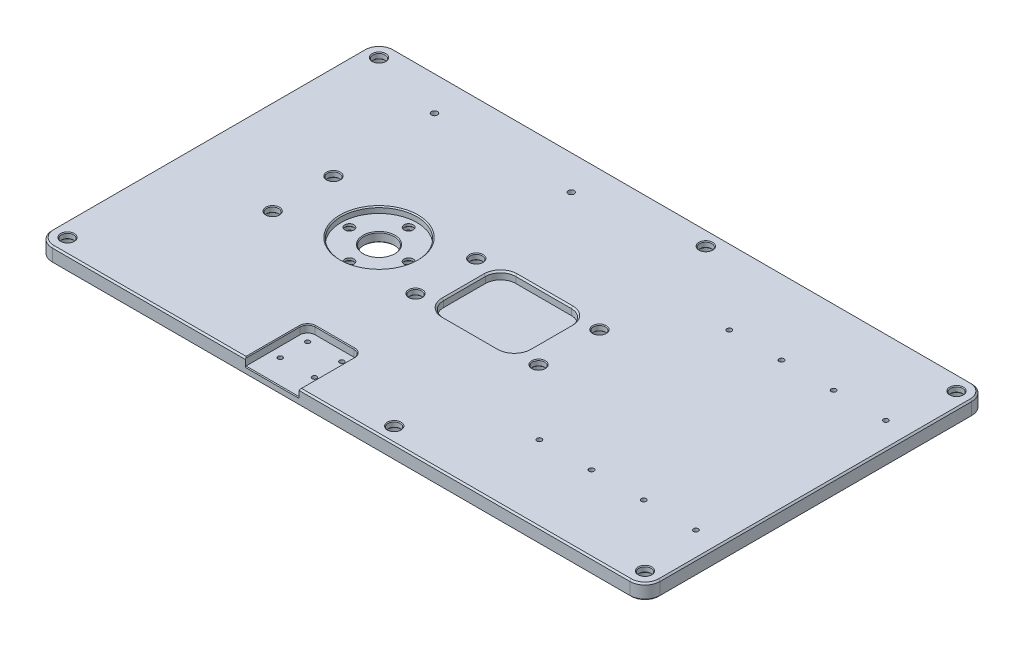
from build123d import *

# Parameters (mm, degrees)
SKICA2_W                  = 400
SKICA2_H                  = 225
P_IDAT_VYSUNUT_M1_DEPTH   = 10
SKICA3_R                  = 4
SKICA3_R_2                = 10
ODEBRAT_VYSUNUT_M1_DEPTH  = 10
SKICA4_R                  = 7.5
SKICA4_R_2                = 7
ODEBRAT_VYSUNUT_M2_DEPTH  = 6
ZAOBLIT1_R                = 10
SKICA6_R                  = 4
ODEBRAT_VYSUNUT_M4_DEPTH  = 10
SKICA7_R                  = 7.5
ODEBRAT_VYSUNUT_M5_DEPTH  = 6
ZKOSEN_1_SIZE             = 0.5
ZKOSEN_2_SIZE             = 0.5
ZKOSEN_3_SIZE             = 0.5
ZKOSEN_5_SIZE             = 1
SKICA8_R                  = 25
ODEBRAT_VYSUNUT_M6_DEPTH  = 4
SKICA10_R                 = 3
ODEBRAT_VYSUNUT_M7_DEPTH  = 6
SKICA11_R                 = 5.5
ODEBRAT_VYSUNUT_M8_DEPTH  = 4
ZKOSEN_7_SIZE             = 0.5
SKICA12_R                 = 1.6
ODEBRAT_VYSUNUT_M9_DEPTH  = 10
ODEBRAT_VYSUNUT_M10_DEPTH = 5
SKICA14_R                 = 1.5
ODEBRAT_VYSUNUT_M11_DEPTH = 5
SKICA15_W                 = 56.5
SKICA15_H                 = 47.5
ODEBRAT_VYSUNUT_M12_DEPTH = 5
ZAOBLIT2_R                = 10
SKICA16_R                 = 2
ODEBRAT_VYSUNUT_M13_DEPTH = 10
SKICA17_R                 = 4
ODEBRAT_VYSUNUT_M14_DEPTH = 4
ZKOSEN_8_SIZE             = 0.5
ZKOSEN_9_SIZE             = 0.5
ZKOSEN_10_SIZE            = 0.7
ZKOSEN_11_SIZE            = 1
ZKOSEN_12_SIZE            = 0.5
ZKOSEN_13_SIZE            = 0.5


with BuildPart() as part:
    # Skica2 → Přidat vysunutím1 (new body)
    with BuildSketch(Plane(origin=(0, 0, 0), x_dir=(1, 0, 0), z_dir=(0, 1, 0))):
        with Locations((200, 112.5)):
            Rectangle(SKICA2_W, SKICA2_H)
    extrude(amount=P_IDAT_VYSUNUT_M1_DEPTH)

    # Skica3 → Odebrat vysunutím1 (cut)
    with BuildSketch(Plane(origin=(0, 10, 0), x_dir=(1, 0, 0), z_dir=(0, 1, 0))):
        with Locations(Location((62.5, 92.5, 0), (0, 0, 270))):
            Circle(SKICA3_R)
        with Locations(Location((62.5, 132.5, 0), (0, 0, 270))):
            Circle(SKICA3_R)
        with Locations(Location((156.5, 92.5, 0), (0, 0, 270))):
            Circle(SKICA3_R)
        with Locations(Location((156.5, 132.5, 0), (0, 0, 270))):
            Circle(SKICA3_R)
        with Locations(Location((237.5, 92.5, 0), (0, 0, 270))):
            Circle(SKICA3_R)
        with Locations(Location((237.5, 132.5, 0), (0, 0, 270))):
            Circle(SKICA3_R)
        with Locations(Location((112.5, 112.5, 0), (0, 0, 270))):
            Circle(SKICA3_R_2)
    extrude(amount=-ODEBRAT_VYSUNUT_M1_DEPTH, mode=Mode.SUBTRACT)

    # Skica4 → Odebrat vysunutím2 (cut)
    with BuildSketch(Plane.XZ):
        with Locations(Location((62.5, -92.5, 0), (0, 0, 270))):
            Circle(SKICA4_R)
        with Locations(Location((62.5, -132.5, 0), (0, 0, 270))):
            Circle(SKICA4_R_2)
        with Locations(Location((156.5, -92.5, 0), (0, 0, 270))):
            Circle(SKICA4_R)
        with Locations(Location((156.5, -132.5, 0), (0, 0, 270))):
            Circle(SKICA4_R)
        with Locations(Location((237.5, -92.5, 0), (0, 0, 270))):
            Circle(SKICA4_R)
        with Locations(Location((237.5, -132.5, 0), (0, 0, 270))):
            Circle(SKICA4_R)
    extrude(amount=-ODEBRAT_VYSUNUT_M2_DEPTH, mode=Mode.SUBTRACT)

    # Zaoblit1
    zaoblit1_edges = [part.edges().sort_by_distance(p)[0] for p in [
        (0, 5, -225),
        (400, 5, -225),
        (400, 5, 0),
        (0, 5, 0),
    ]]
    fillet(zaoblit1_edges, radius=ZAOBLIT1_R)

    # Skica6 → Odebrat vysunutím4 (cut)
    with BuildSketch(Plane.XZ):
        with Locations(Location((10, -10, 0), (0, 0, 270))):
            Circle(SKICA6_R)
        with Locations(Location((390, -10, 0), (0, 0, 270))):
            Circle(SKICA6_R)
        with Locations(Location((390, -215, 0), (0, 0, 270))):
            Circle(SKICA6_R)
        with Locations(Location((10, -215, 0), (0, 0, 270))):
            Circle(SKICA6_R)
        with Locations(Location((225, -10, 0), (0, 0, 270))):
            Circle(SKICA6_R)
        with Locations(Location((225, -215, 0), (0, 0, 270))):
            Circle(SKICA6_R)
    extrude(amount=-ODEBRAT_VYSUNUT_M4_DEPTH, mode=Mode.SUBTRACT)

    # Skica7 → Odebrat vysunutím5 (cut)
    with BuildSketch(Plane.XZ):
        with Locations(Location((10, -10, 0), (0, 0, 270))):
            Circle(SKICA7_R)
        with Locations(Location((390, -10, 0), (0, 0, 270))):
            Circle(SKICA7_R)
        with Locations(Location((10, -215, 0), (0, 0, 270))):
            Circle(SKICA7_R)
        with Locations(Location((390, -215, 0), (0, 0, 270))):
            Circle(SKICA7_R)
        with Locations(Location((225, -10, 0), (0, 0, 270))):
            Circle(SKICA7_R)
        with Locations(Location((225, -215, 0), (0, 0, 270))):
            Circle(SKICA7_R)
    extrude(amount=-ODEBRAT_VYSUNUT_M5_DEPTH, mode=Mode.SUBTRACT)

    # Zkosení1
    zkosen_1_edges = [part.edges().sort_by_distance(p)[0] for p in [
        (62.5, 10, -96.5),
        (62.5, 10, -136.5),
        (156.5, 10, -136.5),
        (237.5, 10, -96.5),
        (237.5, 10, -136.5),
        (156.5, 10, -96.5),
        (237.5, 0, -85),
        (237.5, 6, -96.5),
        (156.5, 0, -125),
        (156.5, 6, -136.5),
        (156.5, 0, -85),
        (156.5, 6, -96.5),
        (62.5, 0, -125.5),
        (62.5, 6, -136.5),
        (237.5, 0, -125),
        (237.5, 6, -136.5),
        (62.5, 0, -85),
        (62.5, 6, -96.5),
    ]]
    chamfer(zkosen_1_edges, length=ZKOSEN_1_SIZE)

    # Zkosení2
    zkosen_2_edges = [part.edges().sort_by_distance(p)[0] for p in [
        (225, 10, -6),
        (390, 10, -211),
        (10, 10, -211),
        (390, 10, -6),
        (225, 10, -211),
        (10, 10, -6),
        (225, 0, -2.5),
        (225, 6, -6),
        (390, 0, -207.5),
        (390, 6, -211),
        (10, 0, -207.5),
        (10, 6, -211),
        (390, 0, -2.5),
        (390, 6, -6),
        (225, 0, -207.5),
        (225, 6, -211),
        (10, 0, -2.5),
        (10, 6, -6),
    ]]
    chamfer(zkosen_2_edges, length=ZKOSEN_2_SIZE)

    # Zkosení3
    zkosen_3_edges = [part.edges().sort_by_distance(p)[0] for p in [
        (112.5, 0, -122.5),
        (112.5, 10, -122.5),
    ]]
    chamfer(zkosen_3_edges, length=ZKOSEN_3_SIZE)

    # Zkosení5
    zkosen_5_edges = [part.edges().sort_by_distance(p)[0] for p in [
        (0, 10, -112.5),
        (200, 10, 0),
        (2.928932188, 10, -222.071067812),
        (2.928932188, 10, -2.928932188),
        (397.071067812, 10, -2.928932188),
        (397.071067812, 10, -222.071067812),
        (200, 0, -225),
        (200, 10, -225),
        (0, 0, -112.5),
        (400, 0, -112.5),
        (200, 0, 0),
        (2.928932188, 0, -222.071067812),
        (2.928932188, 0, -2.928932188),
        (397.071067812, 0, -2.928932188),
        (397.071067812, 0, -222.071067812),
        (400, 10, -112.5),
    ]]
    chamfer(zkosen_5_edges, length=ZKOSEN_5_SIZE)

    # Skica8 → Odebrat vysunutím6 (cut)
    with BuildSketch(Plane(origin=(0, 10, 0), x_dir=(1, 0, 0), z_dir=(0, 1, 0))):
        with Locations(Location((112.5, 112.5, 0), (0, 0, 270))):
            Circle(SKICA8_R)
    extrude(amount=-ODEBRAT_VYSUNUT_M6_DEPTH, mode=Mode.SUBTRACT)

    # Skica10 → Odebrat vysunutím7 (cut)
    with BuildSketch(Plane(origin=(0, 6, 0), x_dir=(1, 0, 0), z_dir=(0, 1, 0))):
        with Locations(Location((112.5, 132, 0), (0, 0, 270))):
            Circle(SKICA10_R)
        with Locations(Location((132, 112.5, 0), (0, 0, 270))):
            Circle(SKICA10_R)
        with Locations(Location((112.5, 93, 0), (0, 0, 270))):
            Circle(SKICA10_R)
        with Locations(Location((93, 112.5, 0), (0, 0, 270))):
            Circle(SKICA10_R)
    extrude(amount=-ODEBRAT_VYSUNUT_M7_DEPTH, mode=Mode.SUBTRACT)

    # Skica11 → Odebrat vysunutím8 (cut)
    with BuildSketch(Plane.XZ):
        with Locations(Location((112.5, -93, 0), (0, 0, 270))):
            Circle(SKICA11_R)
        with Locations(Location((132, -112.5, 0), (0, 0, 270))):
            Circle(SKICA11_R)
        with Locations(Location((112.5, -132, 0), (0, 0, 270))):
            Circle(SKICA11_R)
        with Locations(Location((93, -112.5, 0), (0, 0, 270))):
            Circle(SKICA11_R)
    extrude(amount=-ODEBRAT_VYSUNUT_M8_DEPTH, mode=Mode.SUBTRACT)

    # Zkosení7
    zkosen_7_edges = [part.edges().sort_by_distance(p)[0] for p in [
        (112.5, 6, -122.5),
    ]]
    chamfer(zkosen_7_edges, length=ZKOSEN_7_SIZE)

    # Skica12 → Odebrat vysunutím9 (cut)
    with BuildSketch(Plane(origin=(0, 10, 0), x_dir=(1, 0, 0), z_dir=(0, 1, 0))):
        with Locations(Location((383.49, 50, 0), (0, 0, 270))):
            Circle(SKICA12_R)
        with Locations(Location((349.16, 50, 0), (0, 0, 270))):
            Circle(SKICA12_R)
        with Locations(Location((314.83, 50, 0), (0, 0, 270))):
            Circle(SKICA12_R)
        with Locations(Location((280.5, 50, 0), (0, 0, 270))):
            Circle(SKICA12_R)
        with Locations(Location((280.5, 175, 0), (0, 0, 90))):
            Circle(SKICA12_R)
        with Locations(Location((314.83, 175, 0), (0, 0, 90))):
            Circle(SKICA12_R)
        with Locations(Location((349.16, 175, 0), (0, 0, 90))):
            Circle(SKICA12_R)
        with Locations(Location((383.49, 175, 0), (0, 0, 90))):
            Circle(SKICA12_R)
    extrude(amount=-ODEBRAT_VYSUNUT_M9_DEPTH, mode=Mode.SUBTRACT)

    # Skica13 → Odebrat vysunutím10 (cut)
    with BuildSketch(Plane(origin=(0, 10, 0), x_dir=(1, 0, 0), z_dir=(0, 1, 0))):
        with BuildLine():
            Line((142, 41), (167.5, 41))
            ThreePointArc((167.5, 41), (171.035533906, 39.535533906), (172.5, 36))
            Line((172.5, 36), (172.5, -17.524696406))
            Line((172.5, -17.524696406), (137, -17.524696406))
            Line((137, -17.524696406), (137, 36))
            ThreePointArc((137, 36), (138.464466094, 39.535533906), (142, 41))
        make_face()
    extrude(amount=-ODEBRAT_VYSUNUT_M10_DEPTH, mode=Mode.SUBTRACT)

    # Skica14 → Odebrat vysunutím11 (cut)
    with BuildSketch(Plane(origin=(0, 5, 0), x_dir=(1, 0, 0), z_dir=(0, 1, 0))):
        with Locations(Location((143.5, 34.5, 0), (0, 0, 270))):
            Circle(SKICA14_R)
        with Locations(Location((166, 34.5, 0), (0, 0, 270))):
            Circle(SKICA14_R)
        with Locations(Location((166, 16.5, 0), (0, 0, 270))):
            Circle(SKICA14_R)
        with Locations(Location((143.5, 16.5, 0), (0, 0, 270))):
            Circle(SKICA14_R)
    extrude(amount=-ODEBRAT_VYSUNUT_M11_DEPTH, mode=Mode.SUBTRACT)

    # Skica15 → Odebrat vysunutím12 (cut)
    with BuildSketch(Plane(origin=(0, 10, 0), x_dir=(1, 0, 0), z_dir=(0, 1, 0))):
        with Locations((197, 112.5)):
            Rectangle(SKICA15_W, SKICA15_H)
    extrude(amount=-ODEBRAT_VYSUNUT_M12_DEPTH, mode=Mode.SUBTRACT)

    # Zaoblit2
    zaoblit2_edges = [part.edges().sort_by_distance(p)[0] for p in [
        (168.75, 7.5, -88.75),
        (168.75, 7.5, -136.25),
        (225.25, 7.5, -136.25),
        (225.25, 7.5, -88.75),
    ]]
    fillet(zaoblit2_edges, radius=ZAOBLIT2_R)

    # Skica16 → Odebrat vysunutím13 (cut)
    with BuildSketch(Plane.XZ):
        with Locations(Location((60, -201.5, 0), (0, 0, 270))):
            Circle(SKICA16_R)
        with Locations(Location((150, -201.5, 0), (0, 0, 270))):
            Circle(SKICA16_R)
    extrude(amount=-ODEBRAT_VYSUNUT_M13_DEPTH, mode=Mode.SUBTRACT)

    # Skica17 → Odebrat vysunutím14 (cut)
    with BuildSketch(Plane.XZ):
        with Locations(Location((60, -201.5, 0), (0, 0, 270))):
            Circle(SKICA17_R)
        with Locations(Location((150, -201.5, 0), (0, 0, 270))):
            Circle(SKICA17_R)
    extrude(amount=-ODEBRAT_VYSUNUT_M14_DEPTH, mode=Mode.SUBTRACT)

    # Zkosení8
    zkosen_8_edges = [part.edges().sort_by_distance(p)[0] for p in [
        (60, 0, -197.5),
        (60, 4, -199.5),
        (150, 0, -197.5),
        (150, 4, -199.5),
    ]]
    chamfer(zkosen_8_edges, length=ZKOSEN_8_SIZE)

    # Zkosení9
    zkosen_9_edges = [part.edges().sort_by_distance(p)[0] for p in [
        (112.5, 0, -87.5),
        (112.5, 4, -96),
        (132, 0, -107),
        (132, 4, -115.5),
        (112.5, 0, -126.5),
        (112.5, 4, -135),
        (93, 0, -107),
        (93, 4, -115.5),
    ]]
    chamfer(zkosen_9_edges, length=ZKOSEN_9_SIZE)

    # Zkosení10
    zkosen_10_edges = [part.edges().sort_by_distance(p)[0] for p in [
        (112.5, 10, -137.5),
    ]]
    chamfer(zkosen_10_edges, length=ZKOSEN_10_SIZE)

    # Zkosení11
    zkosen_11_edges = [part.edges().sort_by_distance(p)[0] for p in [
        (225.25, 10, -112.5),
        (197, 10, -88.75),
        (168.75, 10, -112.5),
        (197, 10, -136.25),
        (222.321067812, 10, -91.678932188),
        (171.678932188, 10, -91.678932188),
        (222.321067812, 10, -133.321067812),
        (171.678932188, 10, -133.321067812),
    ]]
    chamfer(zkosen_11_edges, length=ZKOSEN_11_SIZE)

    # Zkosení12
    zkosen_12_edges = [part.edges().sort_by_distance(p)[0] for p in [
        (172.5, 10, -18.5),
        (171.035533906, 10, -39.535533906),
        (154.75, 10, -41),
        (138.464466094, 10, -39.535533906),
        (137, 10, -18.5),
    ]]
    chamfer(zkosen_12_edges, length=ZKOSEN_12_SIZE)

    # Zkosení13
    zkosen_13_edges = [part.edges().sort_by_distance(p)[0] for p in [
        (154.75, 5, 0),
    ]]
    chamfer(zkosen_13_edges, length=ZKOSEN_13_SIZE)


solid = part.part
